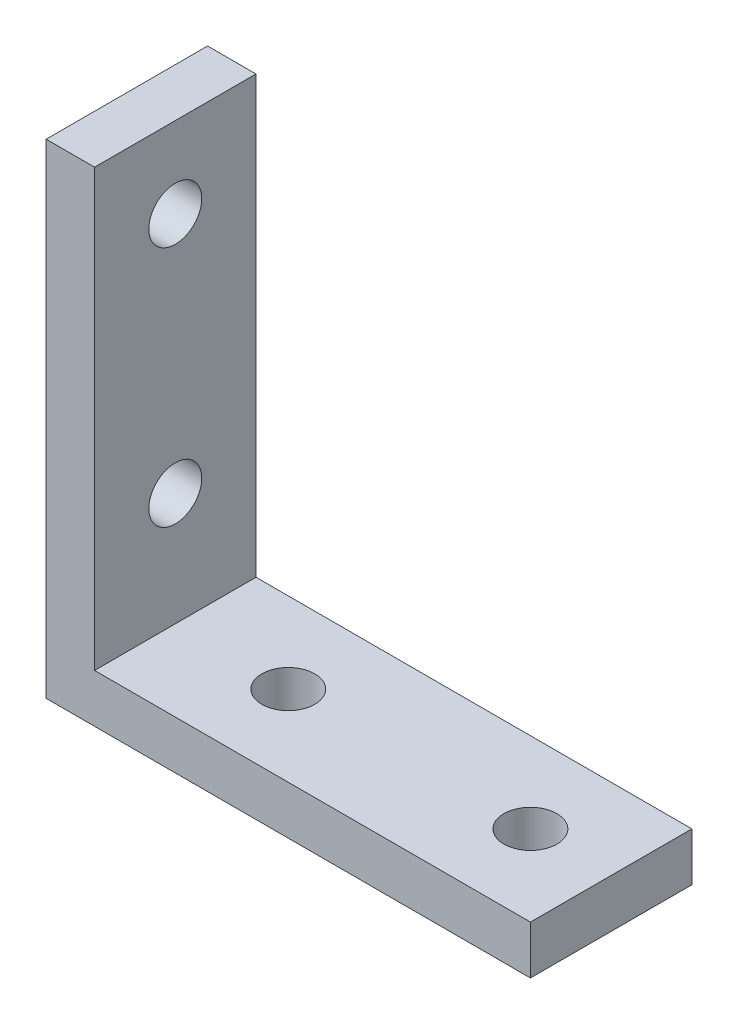
from build123d import *

# Parameters (mm, degrees)
SKETCH1_W           = 38.1
SKETCH1_H           = 12.7
SKETCH1_R           = 2.0828
BOSS_EXTRUDE1_DEPTH = 3.81
SKETCH2_W           = 12.7
SKETCH2_H           = 38.1
SKETCH2_R           = 2.0828
BOSS_EXTRUDE2_DEPTH = 3.81


with BuildPart() as part:
    # Sketch1 → Boss-Extrude1 (new body)
    with BuildSketch(Plane(origin=(0, 0, 0), x_dir=(1, 0, 0), z_dir=(0, 1, 0))):
        with Locations((19.05, 6.35)):
            Rectangle(SKETCH1_W, SKETCH1_H)
        with Locations(Location((12.7, 6.35, 0), (0, 0, 90))):
            Circle(SKETCH1_R, mode=Mode.SUBTRACT)
        with Locations(Location((31.75, 6.35, 0), (0, 0, 90))):
            Circle(SKETCH1_R, mode=Mode.SUBTRACT)
    extrude(amount=BOSS_EXTRUDE1_DEPTH)

    # Sketch2 → Boss-Extrude2 (add)
    with BuildSketch(Plane.ZY):
        with Locations((-6.35, 19.05)):
            Rectangle(SKETCH2_W, SKETCH2_H)
        with Locations((-6.35, 31.75)):
            Circle(SKETCH2_R, mode=Mode.SUBTRACT)
        with Locations((-6.35, 12.7)):
            Circle(SKETCH2_R, mode=Mode.SUBTRACT)
    extrude(amount=-BOSS_EXTRUDE2_DEPTH)


solid = part.part
